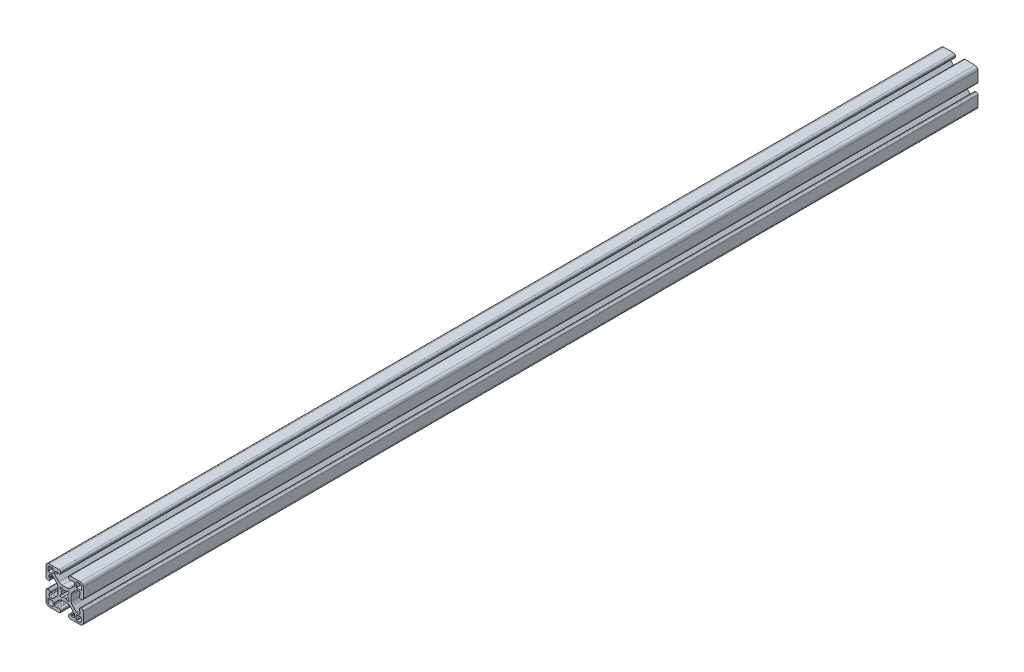
from build123d import *

# Parameters (mm, degrees)
EXTRUDE1_DEPTH = 914.4


with BuildPart() as part:
    # Sketch1 → Extrude1 (new body)
    with BuildSketch(Plane.XY):
        with BuildLine():
            Line((-46.536576176, -7.000809431), (-46.536576176, -8.777954338))
            ThreePointArc((-46.536576176, -8.777954338), (-46.908699375, -9.676339213), (-47.80708425, -10.048462412))
            Line((-47.80708425, -10.048462412), (-49.392574473, -10.048462412))
            ThreePointArc((-49.392574473, -10.048462412), (-49.878776864, -9.951750743), (-50.290959348, -9.676339213))
            Line((-50.290959348, -9.676339213), (-54.238747555, -5.728551005))
            ThreePointArc((-54.238747555, -5.728551005), (-55.268374769, -4.187604983), (-55.629931766, -2.369935216))
            Line((-55.629931766, -2.369935216), (-55.629931766, 2.846651223))
            ThreePointArc((-55.629931766, 2.846651223), (-55.268374769, 4.66432099), (-54.238747555, 6.205267012))
            Line((-54.238747555, 6.205267012), (-50.290959348, 10.153055219))
            ThreePointArc((-50.290959348, 10.153055219), (-49.878776864, 10.42846675), (-49.392574473, 10.525178419))
            Line((-49.392574473, 10.525178419), (-47.80708425, 10.525178419))
            ThreePointArc((-47.80708425, 10.525178419), (-46.908699375, 10.153055219), (-46.536576176, 9.254670344))
            Line((-46.536576176, 9.254670344), (-46.536576176, 7.477525438))
            ThreePointArc((-46.536576176, 7.477525438), (-46.648198166, 7.208046115), (-46.917677488, 7.096424125))
            Line((-46.917677488, 7.096424125), (-46.993886032, 7.096424125))
            ThreePointArc((-46.993886032, 7.096424125), (-47.263365354, 6.984802135), (-47.374987345, 6.715322812))
            Line((-47.374987345, 6.715322812), (-47.374987345, 5.877157808))
            ThreePointArc((-47.374987345, 5.877157808), (-46.913732292, 4.763589604), (-45.800164087, 4.302334551))
            Line((-45.800164087, 4.302334551), (-44.88575238, 4.302334551))
            ThreePointArc((-44.88575238, 4.302334551), (-43.772184176, 4.763589604), (-43.310929123, 5.877157808))
            Line((-43.310929123, 5.877157808), (-43.310929123, 16.113359352))
            ThreePointArc((-43.310929123, 16.113359352), (-44.240867524, 18.358429251), (-46.485937423, 19.288367652))
            Line((-46.485937423, 19.288367652), (-56.722138966, 19.288367652))
            ThreePointArc((-56.722138966, 19.288367652), (-57.835707171, 18.827112599), (-58.296962224, 17.713544394))
            Line((-58.296962224, 17.713544394), (-58.296962224, 16.799132687))
            ThreePointArc((-58.296962224, 16.799132687), (-57.835707171, 15.685564483), (-56.722138966, 15.22430943))
            Line((-56.722138966, 15.22430943), (-55.883973962, 15.22430943))
            ThreePointArc((-55.883973962, 15.22430943), (-55.61449464, 15.33593142), (-55.50287265, 15.605410743))
            Line((-55.50287265, 15.605410743), (-55.50287265, 15.681619286))
            ThreePointArc((-55.50287265, 15.681619286), (-55.391250659, 15.951098609), (-55.121771337, 16.062720599))
            Line((-55.121771337, 16.062720599), (-53.34462643, 16.062720599))
            ThreePointArc((-53.34462643, 16.062720599), (-52.446241555, 15.690597399), (-52.074118356, 14.792212524))
            Line((-52.074118356, 14.792212524), (-52.074118356, 13.206722301))
            ThreePointArc((-52.074118356, 13.206722301), (-52.170830024, 12.720519911), (-52.446241555, 12.308337426))
            Line((-52.446241555, 12.308337426), (-56.394029762, 8.360549219))
            ThreePointArc((-56.394029762, 8.360549219), (-57.934975784, 7.330922005), (-59.752645551, 6.969365009))
            Line((-59.752645551, 6.969365009), (-64.969231991, 6.969365009))
            ThreePointArc((-64.969231991, 6.969365009), (-66.786901758, 7.330922005), (-68.32784778, 8.360549219))
            Line((-68.32784778, 8.360549219), (-72.275635987, 12.308337426))
            ThreePointArc((-72.275635987, 12.308337426), (-72.551047518, 12.720519911), (-72.647759186, 13.206722301))
            Line((-72.647759186, 13.206722301), (-72.647759186, 14.792212524))
            ThreePointArc((-72.647759186, 14.792212524), (-72.275635987, 15.690597399), (-71.377251112, 16.062720599))
            Line((-71.377251112, 16.062720599), (-69.600106205, 16.062720599))
            ThreePointArc((-69.600106205, 16.062720599), (-69.330626883, 15.951098609), (-69.219004892, 15.681619286))
            Line((-69.219004892, 15.681619286), (-69.219004892, 15.605410743))
            ThreePointArc((-69.219004892, 15.605410743), (-69.107382902, 15.33593142), (-68.83790358, 15.22430943))
            Line((-68.83790358, 15.22430943), (-67.999738576, 15.22430943))
            ThreePointArc((-67.999738576, 15.22430943), (-66.886170371, 15.685564483), (-66.424915318, 16.799132687))
            Line((-66.424915318, 16.799132687), (-66.424915318, 17.713544394))
            ThreePointArc((-66.424915318, 17.713544394), (-66.886170371, 18.827112599), (-67.999738576, 19.288367652))
            Line((-67.999738576, 19.288367652), (-78.235940119, 19.288367652))
            ThreePointArc((-78.235940119, 19.288367652), (-80.481010019, 18.358429251), (-81.410948419, 16.113359352))
            Line((-81.410948419, 16.113359352), (-81.410948419, 5.877157808))
            ThreePointArc((-81.410948419, 5.877157808), (-80.949693366, 4.763589604), (-79.836125162, 4.302334551))
            Line((-79.836125162, 4.302334551), (-78.921713455, 4.302334551))
            ThreePointArc((-78.921713455, 4.302334551), (-77.80814525, 4.763589604), (-77.346890198, 5.877157808))
            Line((-77.346890198, 5.877157808), (-77.346890198, 6.715322812))
            ThreePointArc((-77.346890198, 6.715322812), (-77.458512188, 6.984802135), (-77.72799151, 7.096424125))
            Line((-77.72799151, 7.096424125), (-77.804200054, 7.096424125))
            ThreePointArc((-77.804200054, 7.096424125), (-78.073679376, 7.208046115), (-78.185301366, 7.477525438))
            Line((-78.185301366, 7.477525438), (-78.185301366, 9.254670344))
            ThreePointArc((-78.185301366, 9.254670344), (-77.813178167, 10.153055219), (-76.914793292, 10.525178419))
            Line((-76.914793292, 10.525178419), (-75.329303069, 10.525178419))
            ThreePointArc((-75.329303069, 10.525178419), (-74.843100678, 10.42846675), (-74.430918194, 10.153055219))
            Line((-74.430918194, 10.153055219), (-70.483129987, 6.205267012))
            ThreePointArc((-70.483129987, 6.205267012), (-69.453502773, 4.66432099), (-69.091945776, 2.846651223))
            Line((-69.091945776, 2.846651223), (-69.091945776, -2.369935216))
            ThreePointArc((-69.091945776, -2.369935216), (-69.453502773, -4.187604983), (-70.483129987, -5.728551005))
            Line((-70.483129987, -5.728551005), (-74.430918194, -9.676339213))
            ThreePointArc((-74.430918194, -9.676339213), (-74.843100678, -9.951750743), (-75.329303069, -10.048462412))
            Line((-75.329303069, -10.048462412), (-76.914793292, -10.048462412))
            ThreePointArc((-76.914793292, -10.048462412), (-77.813178167, -9.676339213), (-78.185301366, -8.777954338))
            Line((-78.185301366, -8.777954338), (-78.185301366, -7.000809431))
            ThreePointArc((-78.185301366, -7.000809431), (-78.073679376, -6.731330108), (-77.804200054, -6.619708118))
            Line((-77.804200054, -6.619708118), (-77.72799151, -6.619708118))
            ThreePointArc((-77.72799151, -6.619708118), (-77.458512188, -6.508086128), (-77.346890198, -6.238606805))
            Line((-77.346890198, -6.238606805), (-77.346890198, -5.400441801))
            ThreePointArc((-77.346890198, -5.400441801), (-77.80814525, -4.286873597), (-78.921713455, -3.825618544))
            Line((-78.921713455, -3.825618544), (-79.836125162, -3.825618544))
            ThreePointArc((-79.836125162, -3.825618544), (-80.949693366, -4.286873597), (-81.410948419, -5.400441801))
            Line((-81.410948419, -5.400441801), (-81.410948419, -15.636643345))
            ThreePointArc((-81.410948419, -15.636643345), (-80.481010019, -17.881713244), (-78.235940119, -18.811651645))
            Line((-78.235940119, -18.811651645), (-67.999738576, -18.811651645))
            ThreePointArc((-67.999738576, -18.811651645), (-66.886170371, -18.350396592), (-66.424915318, -17.236828387))
            Line((-66.424915318, -17.236828387), (-66.424915318, -16.322416681))
            ThreePointArc((-66.424915318, -16.322416681), (-66.886170371, -15.208848476), (-67.999738576, -14.747593423))
            Line((-67.999738576, -14.747593423), (-68.83790358, -14.747593423))
            ThreePointArc((-68.83790358, -14.747593423), (-69.107382902, -14.859215413), (-69.219004892, -15.128694736))
            Line((-69.219004892, -15.128694736), (-69.219004892, -15.204903279))
            ThreePointArc((-69.219004892, -15.204903279), (-69.330626883, -15.474382602), (-69.600106205, -15.586004592))
            Line((-69.600106205, -15.586004592), (-71.377251112, -15.586004592))
            ThreePointArc((-71.377251112, -15.586004592), (-72.275635987, -15.213881393), (-72.647759186, -14.315496518))
            Line((-72.647759186, -14.315496518), (-72.647759186, -12.730006294))
            ThreePointArc((-72.647759186, -12.730006294), (-72.551047518, -12.243803904), (-72.275635987, -11.831621419))
            Line((-72.275635987, -11.831621419), (-68.32784778, -7.883833212))
            ThreePointArc((-68.32784778, -7.883833212), (-66.786901758, -6.854205998), (-64.969231991, -6.492649002))
            Line((-64.969231991, -6.492649002), (-59.752645551, -6.492649002))
            ThreePointArc((-59.752645551, -6.492649002), (-57.934975784, -6.854205998), (-56.394029762, -7.883833212))
            Line((-56.394029762, -7.883833212), (-52.446241555, -11.831621419))
            ThreePointArc((-52.446241555, -11.831621419), (-52.170830024, -12.243803904), (-52.074118356, -12.730006294))
            Line((-52.074118356, -12.730006294), (-52.074118356, -14.315496518))
            ThreePointArc((-52.074118356, -14.315496518), (-52.446241555, -15.213881393), (-53.34462643, -15.586004592))
            Line((-53.34462643, -15.586004592), (-55.121771337, -15.586004592))
            ThreePointArc((-55.121771337, -15.586004592), (-55.391250659, -15.474382602), (-55.50287265, -15.204903279))
            Line((-55.50287265, -15.204903279), (-55.50287265, -15.128694736))
            ThreePointArc((-55.50287265, -15.128694736), (-55.61449464, -14.859215413), (-55.883973962, -14.747593423))
            Line((-55.883973962, -14.747593423), (-56.722138966, -14.747593423))
            ThreePointArc((-56.722138966, -14.747593423), (-57.835707171, -15.208848476), (-58.296962224, -16.322416681))
            Line((-58.296962224, -16.322416681), (-58.296962224, -17.236828387))
            ThreePointArc((-58.296962224, -17.236828387), (-57.835707171, -18.350396592), (-56.722138966, -18.811651645))
            Line((-56.722138966, -18.811651645), (-46.485937423, -18.811651645))
            ThreePointArc((-46.485937423, -18.811651645), (-44.240867524, -17.881713244), (-43.310929123, -15.636643345))
            Line((-43.310929123, -15.636643345), (-43.310929123, -5.400441801))
            ThreePointArc((-43.310929123, -5.400441801), (-43.772184176, -4.286873597), (-44.88575238, -3.825618544))
            Line((-44.88575238, -3.825618544), (-45.800164087, -3.825618544))
            ThreePointArc((-45.800164087, -3.825618544), (-46.913732292, -4.286873597), (-47.374987345, -5.400441801))
            Line((-47.374987345, -5.400441801), (-47.374987345, -6.238606805))
            ThreePointArc((-47.374987345, -6.238606805), (-47.263365354, -6.508086128), (-46.993886032, -6.619708118))
            Line((-46.993886032, -6.619708118), (-46.917677488, -6.619708118))
            ThreePointArc((-46.917677488, -6.619708118), (-46.648198166, -6.731330108), (-46.536576176, -7.000809431))
        make_face()
        with BuildLine():
            Line((-66.704225911, -2.488503773), (-65.333805065, -1.118082926))
            ThreePointArc((-65.333805065, -1.118082926), (-65.628635038, 0.238350998), (-65.333805065, 1.594784923))
            Line((-65.333805065, 1.594784923), (-66.704225911, 2.96520577))
            ThreePointArc((-66.704225911, 2.96520577), (-66.704225911, 4.581651871), (-65.087779809, 4.581651871))
            Line((-65.087779809, 4.581651871), (-63.717358963, 3.211231025))
            ThreePointArc((-63.717358963, 3.211231025), (-62.360925038, 3.506060998), (-61.004491114, 3.211231025))
            Line((-61.004491114, 3.211231025), (-59.721163841, 4.483961819))
            ThreePointArc((-59.721163841, 4.483961819), (-58.017624165, 4.581651871), (-58.115314218, 2.878112196))
            Line((-58.115314218, 2.878112196), (-59.388045012, 1.594784923))
            ThreePointArc((-59.388045012, 1.594784923), (-59.093215038, 0.238350998), (-59.388045012, -1.118082926))
            Line((-59.388045012, -1.118082926), (-58.017624165, -2.488503773))
            ThreePointArc((-58.017624165, -2.488503773), (-58.017624165, -4.104949875), (-59.634070267, -4.104949875))
            Line((-59.634070267, -4.104949875), (-61.004491114, -2.734529028))
            ThreePointArc((-61.004491114, -2.734529028), (-62.360925038, -3.029359002), (-63.717358963, -2.734529028))
            Line((-63.717358963, -2.734529028), (-65.087779809, -4.104949875))
            ThreePointArc((-65.087779809, -4.104949875), (-66.704225911, -4.104949875), (-66.704225911, -2.488503773))
        make_face(mode=Mode.SUBTRACT)
        with BuildLine():
            Line((-79.607590804, 12.481182993), (-79.607590804, 14.690971736))
            ThreePointArc((-79.607590804, 14.690971736), (-78.789237259, 16.666651962), (-76.813557033, 17.485005507))
            Line((-76.813557033, 17.485005507), (-74.60376829, 17.485005507))
            ThreePointArc((-74.60376829, 17.485005507), (-74.334288967, 17.373383517), (-74.222666977, 17.103904194))
            Line((-74.222666977, 17.103904194), (-74.222666977, 12.481182993))
            ThreePointArc((-74.222666977, 12.481182993), (-74.334288967, 12.211703671), (-74.60376829, 12.10008168))
            Line((-74.60376829, 12.10008168), (-79.226489491, 12.10008168))
            ThreePointArc((-79.226489491, 12.10008168), (-79.495968814, 12.211703671), (-79.607590804, 12.481182993))
        make_face(mode=Mode.SUBTRACT)
        with BuildLine():
            Line((-74.60376829, -17.008273292), (-76.813557033, -17.008273292))
            ThreePointArc((-76.813557033, -17.008273292), (-78.789237259, -16.189919747), (-79.607590804, -14.214239521))
            Line((-79.607590804, -14.214239521), (-79.607590804, -12.004450778))
            ThreePointArc((-79.607590804, -12.004450778), (-79.495968814, -11.734971455), (-79.226489491, -11.623349465))
            Line((-79.226489491, -11.623349465), (-74.60376829, -11.623349465))
            ThreePointArc((-74.60376829, -11.623349465), (-74.334288967, -11.734971455), (-74.222666977, -12.004450778))
            Line((-74.222666977, -12.004450778), (-74.222666977, -16.627171979))
            ThreePointArc((-74.222666977, -16.627171979), (-74.334288967, -16.896651302), (-74.60376829, -17.008273292))
        make_face(mode=Mode.SUBTRACT)
        with BuildLine():
            Line((-45.114312005, -12.004450778), (-45.114312005, -14.214239521))
            ThreePointArc((-45.114312005, -14.214239521), (-45.93266555, -16.189919747), (-47.908345776, -17.008273292))
            Line((-47.908345776, -17.008273292), (-50.118134519, -17.008273292))
            ThreePointArc((-50.118134519, -17.008273292), (-50.387613842, -16.896651302), (-50.499235832, -16.627171979))
            Line((-50.499235832, -16.627171979), (-50.499235832, -12.004450778))
            ThreePointArc((-50.499235832, -12.004450778), (-50.387613842, -11.734971455), (-50.118134519, -11.623349465))
            Line((-50.118134519, -11.623349465), (-45.495413318, -11.623349465))
            ThreePointArc((-45.495413318, -11.623349465), (-45.225933995, -11.734971455), (-45.114312005, -12.004450778))
        make_face(mode=Mode.SUBTRACT)
        with BuildLine():
            Line((-50.118134519, 17.485005507), (-47.908345776, 17.485005507))
            ThreePointArc((-47.908345776, 17.485005507), (-45.93266555, 16.666651962), (-45.114312005, 14.690971736))
            Line((-45.114312005, 14.690971736), (-45.114312005, 12.481182993))
            ThreePointArc((-45.114312005, 12.481182993), (-45.225933995, 12.211703671), (-45.495413318, 12.10008168))
            Line((-45.495413318, 12.10008168), (-50.118134519, 12.10008168))
            ThreePointArc((-50.118134519, 12.10008168), (-50.387613842, 12.211703671), (-50.499235832, 12.481182993))
            Line((-50.499235832, 12.481182993), (-50.499235832, 17.103904194))
            ThreePointArc((-50.499235832, 17.103904194), (-50.387613842, 17.373383517), (-50.118134519, 17.485005507))
        make_face(mode=Mode.SUBTRACT)
    extrude(amount=-EXTRUDE1_DEPTH)


solid = part.part
